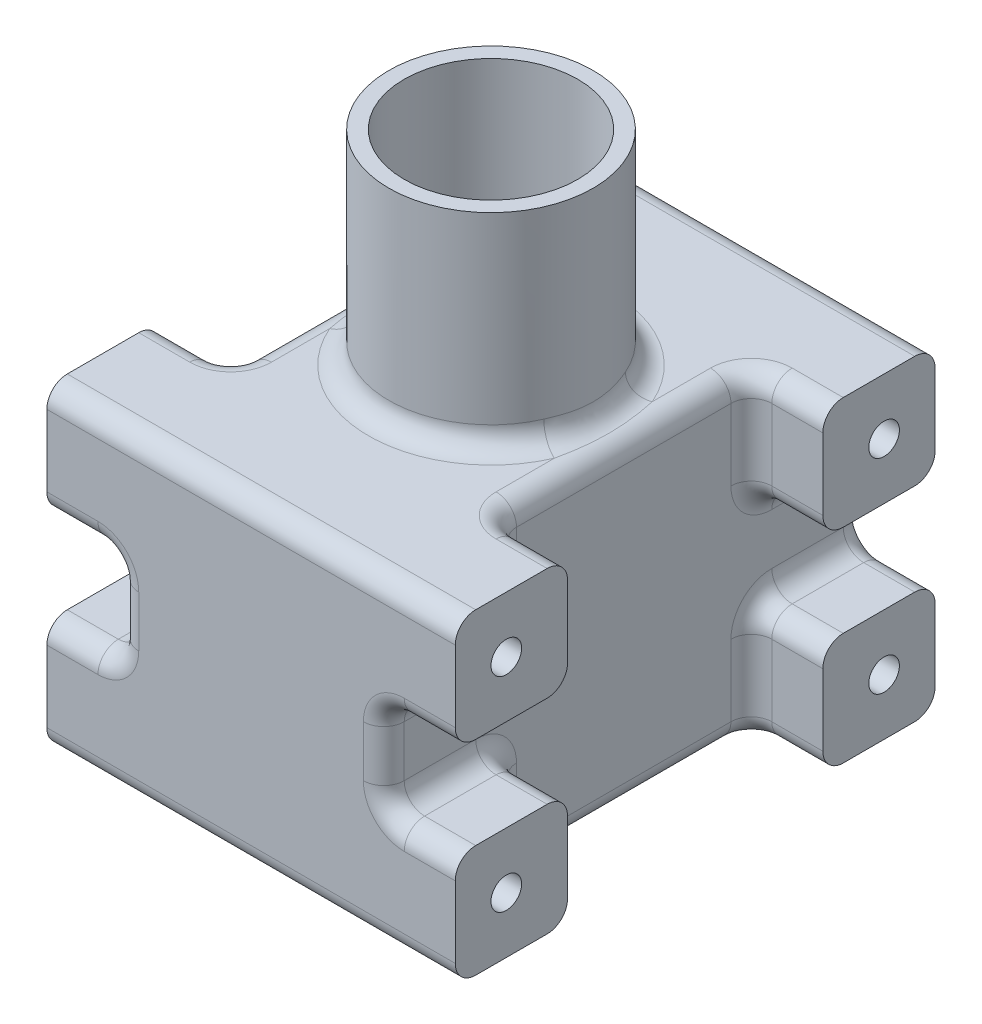
from build123d import *

# Parameters (mm, degrees)
SKETCH1_W           = 40
SKETCH1_H           = 47
BOSS_EXTRUDE1_DEPTH = 31
SKETCH2_R           = 10
BOSS_EXTRUDE2_DEPTH = 20
SKETCH6_R           = 1.5
CUT_EXTRUDE2_DEPTH  = 69.943817707
CUT_EXTRUDE3_DEPTH  = 7
FILLET1_R           = 2
FILLET3_R           = 2
SKETCH9_R           = 8.5
CUT_EXTRUDE4_DEPTH  = 60.609143594


with BuildPart() as part:
    # Sketch1 → Boss-Extrude1 (new body)
    with BuildSketch(Plane(origin=(0, 0, 0), x_dir=(1, 0, 0), z_dir=(0, 1, 0))):
        Rectangle(SKETCH1_W, SKETCH1_H)
    extrude(amount=BOSS_EXTRUDE1_DEPTH)

    # Sketch2 → Boss-Extrude2 (add)
    with BuildSketch(Plane(origin=(0, 31, 0), x_dir=(1, 0, 0), z_dir=(0, 1, 0))):
        Circle(SKETCH2_R)
    extrude(amount=BOSS_EXTRUDE2_DEPTH)

    # Sketch6 → Cut-Extrude2 (cut, through all)
    with BuildSketch(Plane(origin=(20, 0, 0), x_dir=(0, 0, -1), z_dir=(1, 0, 0))):
        with Locations((18.5, 25.5)):
            Circle(SKETCH6_R)
        with Locations((18.5, 5.5)):
            Circle(SKETCH6_R)
        with Locations((-18.5, 5.5)):
            Circle(SKETCH6_R)
        with Locations((-18.5, 25.5)):
            Circle(SKETCH6_R)
    extrude(amount=-CUT_EXTRUDE2_DEPTH, mode=Mode.SUBTRACT)

    # Sketch8 → Cut-Extrude3 (cut)
    with BuildSketch(Plane.ZY.offset(20)):
        Polygon((12.5, 11), (23.5, 11), (23.5, 20), (12.5, 20), (12.5, 31), (-12.5, 31), (-12.5, 20), (-23.5, 20), (-23.5, 11), (-12.5, 11), (-12.5, 0), (12.5, 0), align=None)
    cut_extrude3 = extrude(amount=-CUT_EXTRUDE3_DEPTH, mode=Mode.SUBTRACT)

    # Mirror1: Cut-Extrude3 across plane
    add(cut_extrude3.mirror(Plane(origin=(0, 0, 0), x_dir=(0, 0, 1), z_dir=(1, 0, 0))), mode=Mode.SUBTRACT)

    # Fillet1
    fillet1_edges = [part.edges().sort_by_distance(p)[0] for p in [
        (-16.5, 31, 12.5),
        (-16.5, 31, -12.5),
        (-16.5, 20, 23.5),
        (-16.5, 11, 23.5),
        (-16.5, 0, 12.5),
        (-16.5, 0, -12.5),
        (-16.5, 11, -23.5),
        (-16.5, 20, -23.5),
        (-13, 31, 0),
        (-13, 25.5, 12.5),
        (-13, 20, 18),
        (-13, 15.5, 23.5),
        (-13, 11, 18),
        (-13, 5.5, 12.5),
        (-13, 0, 0),
        (-13, 5.5, -12.5),
        (-13, 11, -18),
        (-13, 15.5, -23.5),
        (-13, 20, -18),
        (-13, 25.5, -12.5),
        (0, 31, -23.5),
        (0, 0, -23.5),
        (0, 0, 23.5),
        (0, 31, 23.5),
        (-16.5, 11, 12.5),
        (-16.5, 11, -12.5),
        (-16.5, 20, -12.5),
        (-16.5, 20, 12.5),
        (16.5, 20, -23.5),
        (16.5, 11, -23.5),
        (16.5, 0, -12.5),
        (16.5, 0, 12.5),
        (16.5, 11, 23.5),
        (16.5, 20, 23.5),
        (16.5, 31, 12.5),
        (16.5, 31, -12.5),
        (13, 20, -18),
        (13, 15.5, -23.5),
        (13, 11, -18),
        (13, 5.5, -12.5),
        (13, 0, 0),
        (13, 5.5, 12.5),
        (13, 11, 18),
        (13, 15.5, 23.5),
        (13, 20, 18),
        (13, 25.5, 12.5),
        (13, 31, 0),
        (13, 25.5, -12.5),
        (16.5, 11, -12.5),
        (16.5, 20, -12.5),
        (16.5, 20, 12.5),
        (16.5, 11, 12.5),
    ]]
    fillet(fillet1_edges, radius=FILLET1_R)

    # Fillet3
    fillet3_edges = [part.edges().sort_by_distance(p)[0] for p in [
        (-10, 31, 0),
    ]]
    fillet(fillet3_edges, radius=FILLET3_R)

    # Sketch9 → Cut-Extrude4 (cut, through all)
    with BuildSketch(Plane(origin=(0, 51, 0), x_dir=(1, 0, 0), z_dir=(0, 1, 0))):
        Circle(SKETCH9_R)
    extrude(amount=-CUT_EXTRUDE4_DEPTH, mode=Mode.SUBTRACT)


solid = part.part
